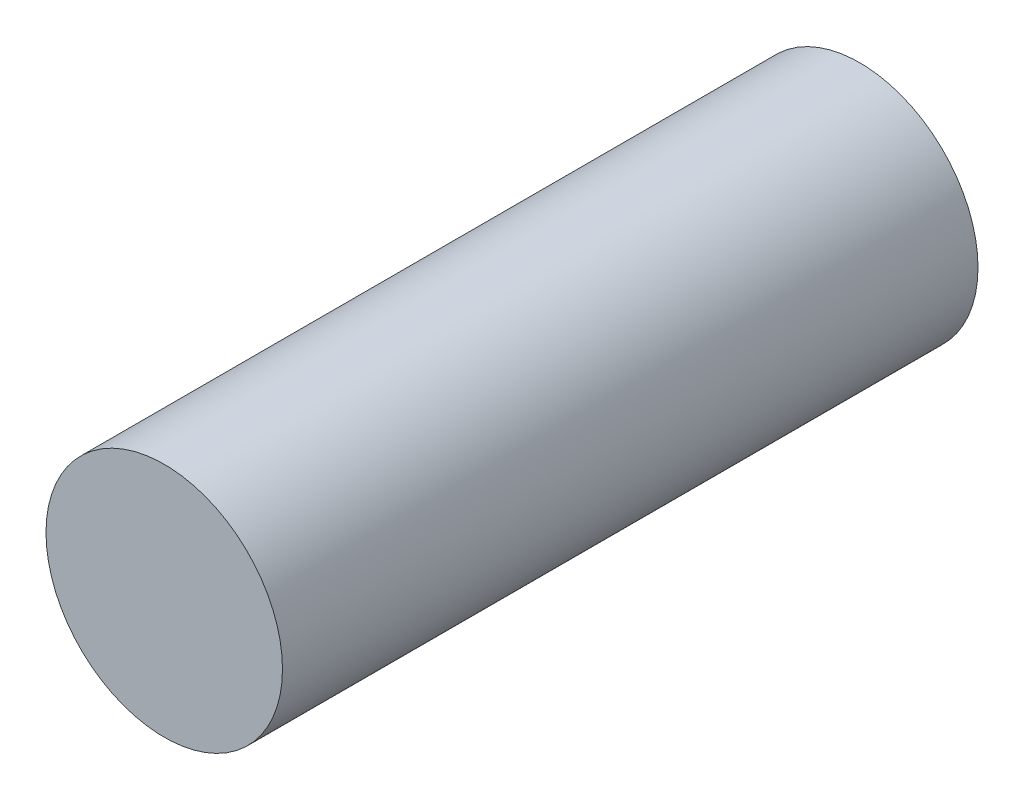
from build123d import *

# Parameters (mm, degrees)
SKETCH1_R           = 4.25
BOSS_EXTRUDE1_DEPTH = 25


with BuildPart() as part:
    # Sketch1 → Boss-Extrude1 (new body)
    with BuildSketch(Plane.XY):
        Circle(SKETCH1_R)
    extrude(amount=BOSS_EXTRUDE1_DEPTH)


solid = part.part
